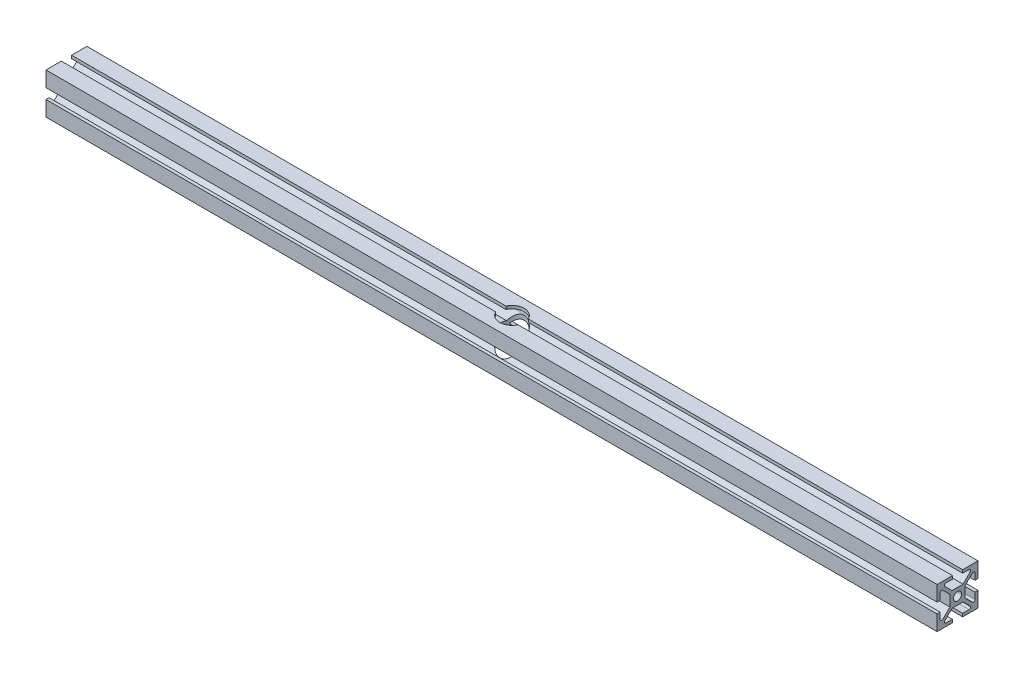
from build123d import *

# Parameters (mm, degrees)
ESQUISSE1_R                     = 2
BOSS_EXTRU_1_DEPTH              = 218
CONG_1_R                        = 0.75
DIAM_TRE_DU_PER_AGE_12_0_12_2_D = 12


with BuildPart() as part:
    # Esquisse1 → Boss.-Extru.1 (new, symmetric)
    with BuildSketch(Plane(origin=(0, 0, 0), x_dir=(0, 0, -1), z_dir=(1, 0, 0))):
        Polygon((2.5, 10), (10, 10), (10, 2.5), (8.5, 2.5), (8.5, 7.439339828), (3.75, 2.689339828), (3.75, -2.689339828), (8.5, -7.439339828), (8.5, -2.5), (10, -2.5), (10, -10), (2.5, -10), (2.5, -8.5), (7.439339828, -8.5), (2.689339828, -3.75), (-2.689339828, -3.75), (-7.439339828, -8.5), (-2.5, -8.5), (-2.5, -10), (-10, -10), (-10, -2.5), (-8.5, -2.5), (-8.5, -7.439339828), (-3.75, -2.689339828), (-3.75, 2.689339828), (-8.5, 7.439339828), (-8.5, 2.5), (-10, 2.5), (-10, 10), (-2.5, 10), (-2.5, 8.5), (-7.439339828, 8.5), (-2.689339828, 3.75), (2.689339828, 3.75), (7.439339828, 8.5), (2.5, 8.5), align=None)
        Circle(ESQUISSE1_R, mode=Mode.SUBTRACT)
    extrude(amount=BOSS_EXTRU_1_DEPTH, both=True)

    # Congé1
    cong_1_edges = [part.edges().sort_by_distance(p)[0] for p in [
        (0, 7.439339828, -8.5),
        (0, -7.439339828, -8.5),
        (0, -8.5, -7.439339828),
        (0, -8.5, 7.439339828),
        (0, -7.439339828, 8.5),
        (0, 7.439339828, 8.5),
        (0, 8.5, 7.439339828),
        (0, 8.5, -7.439339828),
    ]]
    fillet(cong_1_edges, radius=CONG_1_R)

    # Diamètre du perçage Ø12.0 (12)2 (through all)
    with Locations(Plane(origin=(0, 10, 0), x_dir=(1, 0, 0), z_dir=(0, 1, 0))):
        with Locations((0, 0)):
            Hole(DIAM_TRE_DU_PER_AGE_12_0_12_2_D / 2)


solid = part.part
